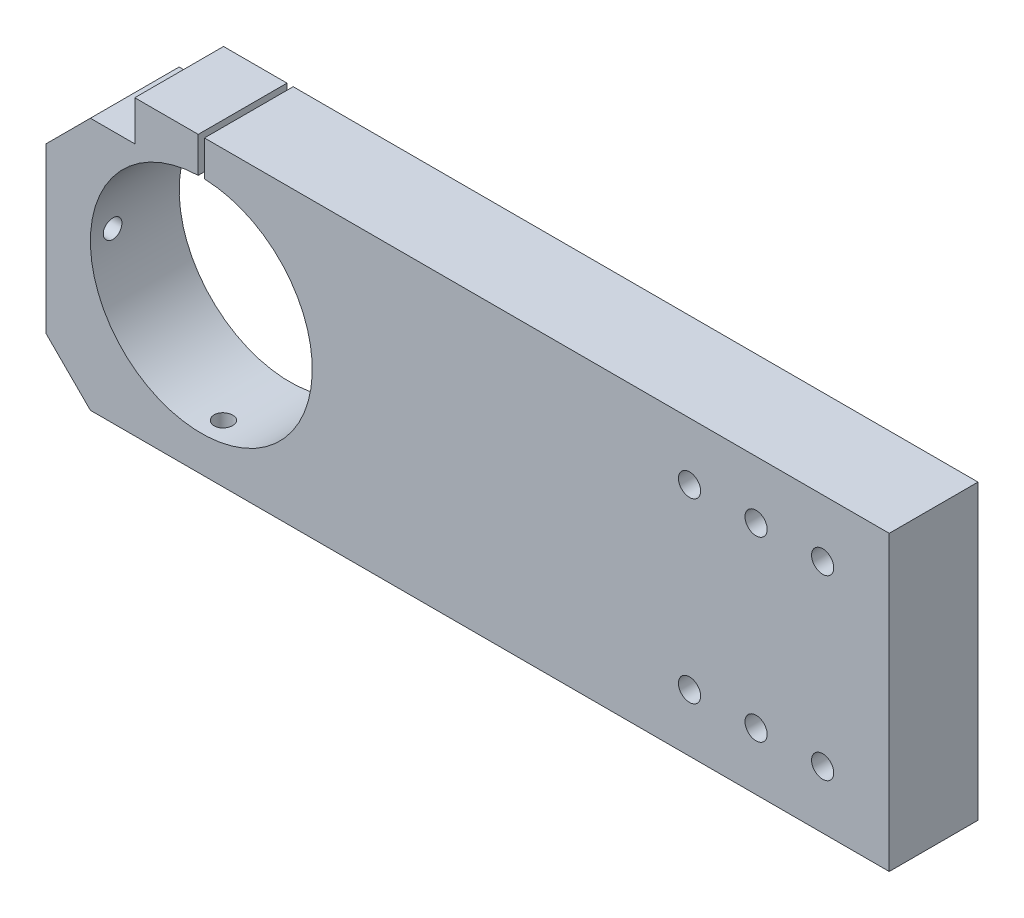
from build123d import *

# Parameters (mm, degrees)
SKETCH_1_W              = 190
SKETCH_1_H              = 66
EXTRUDE_1_DEPTH         = 20
SKETCH_2_R              = 25
CUT_EXTRUDE_1_DEPTH     = 203.12867189
SKETCH_3_W              = 20
SKETCH_3_H              = 9
CUT_EXTRUDE_2_DEPTH     = 203.12867189
SKETCH_4_W              = 1.4
SKETCH_4_H              = 16.93413418
CUT_EXTRUDE_3_DEPTH     = 203.12867189
CHAMFER_1_SIZE          = 10
SKETCH_5_R              = 2.25
CUT_EXTRUDE_4_DEPTH     = 14.3
HOLE_WIZARD_M4_1_D      = 3.3
HOLE_WIZARD_M4_1_DEPTH  = 10.1
HOLE_WIZARD_M4_1_TIP    = 0.991420021
HOLE_WIZARD_M5_1_REACH  = 204.129
HOLE_WIZARD_M5_1_BORE_R = 2.1
HOLE_WIZARD_M5_2_D      = 4.2
HOLE_WIZARD_M5_2_DEPTH  = 12.4
HOLE_WIZARD_M5_2_TIP    = 1.2618073
CHAMFER_2_SIZE          = 10
HOLE_WIZARD_M6_1_D      = 5
PATTERN_LINEAR_1_COUNT  = 3
PATTERN_LINEAR_1_PITCH  = 15


with BuildPart() as part:
    # 草图1 → 凸台-拉伸1 (new body)
    with BuildSketch(Plane.XY):
        with Locations((95, 33)):
            Rectangle(SKETCH_1_W, SKETCH_1_H)
    extrude(amount=EXTRUDE_1_DEPTH)

    # 草图2 → 切除-拉伸1 (cut, through all)
    with BuildSketch(Plane(origin=(0, 0, 0), x_dir=(-1, 0, 0), z_dir=(0, 0, -1))):
        with Locations((-35, 33)):
            Circle(SKETCH_2_R)
    extrude(amount=-CUT_EXTRUDE_1_DEPTH, mode=Mode.SUBTRACT)

    # 草图3 → 切除-拉伸2 (cut, through all)
    with BuildSketch(Plane(origin=(0, 0, 0), x_dir=(-1, 0, 0), z_dir=(0, 0, -1))):
        with Locations((-10, 61.5)):
            Rectangle(SKETCH_3_W, SKETCH_3_H)
    extrude(amount=-CUT_EXTRUDE_2_DEPTH, mode=Mode.SUBTRACT)

    # 草图4 → 切除-拉伸3 (cut, through all)
    with BuildSketch(Plane(origin=(0, 0, 0), x_dir=(-1, 0, 0), z_dir=(0, 0, -1))):
        with Locations((-35, 57.53293291)):
            Rectangle(SKETCH_4_W, SKETCH_4_H)
    extrude(amount=-CUT_EXTRUDE_3_DEPTH, mode=Mode.SUBTRACT)

    # 倒角1
    chamfer_1_edges = [part.edges().sort_by_distance(p)[0] for p in [
        (0, 57, 10),
    ]]
    chamfer(chamfer_1_edges, length=CHAMFER_1_SIZE)

    # 草图5 → 切除-拉伸4 (cut)
    with BuildSketch(Plane.ZY.offset(-20)):
        with Locations(Location((15, 61.5, 0), (0, 0, 270))):
            Circle(SKETCH_5_R)
        with Locations((5, 61.5)):
            Circle(SKETCH_5_R)
    extrude(amount=-CUT_EXTRUDE_4_DEPTH, mode=Mode.SUBTRACT)

    # M4 螺纹孔1
    with Locations(Plane.ZY.offset(-35.7)):
        with Locations((15, 61.5), (5, 61.5)):
            Hole(HOLE_WIZARD_M4_1_D / 2, depth=HOLE_WIZARD_M4_1_DEPTH)
            with Locations((0, 0, -(HOLE_WIZARD_M4_1_DEPTH + HOLE_WIZARD_M4_1_TIP / 2))):  # 118° drill point
                Cone(0, HOLE_WIZARD_M4_1_D / 2, HOLE_WIZARD_M4_1_TIP, mode=Mode.SUBTRACT)

    # M5 螺纹孔1 bore → M5 螺纹孔1 (cut, up to next)
    with BuildSketch(Plane.ZY, mode=Mode.PRIVATE) as hole_wizard_m5_1_sk1:
        with Locations((15, 33)):
            Circle(HOLE_WIZARD_M5_1_BORE_R)
    hole_wizard_m5_1_tool1 = extrude(hole_wizard_m5_1_sk1.sketch, amount=-HOLE_WIZARD_M5_1_REACH, mode=Mode.PRIVATE) & part.part
    add(hole_wizard_m5_1_tool1.solids().sort_by_distance((0, 33, 15))[0], mode=Mode.SUBTRACT)

    # M5 螺纹孔2
    with Locations(Plane.XZ):
        with Locations((35, 15)):
            Hole(HOLE_WIZARD_M5_2_D / 2, depth=HOLE_WIZARD_M5_2_DEPTH)
            with Locations((0, 0, -(HOLE_WIZARD_M5_2_DEPTH + HOLE_WIZARD_M5_2_TIP / 2))):  # 118° drill point
                Cone(0, HOLE_WIZARD_M5_2_D / 2, HOLE_WIZARD_M5_2_TIP, mode=Mode.SUBTRACT)

    # 倒角2
    chamfer_2_edges = [part.edges().sort_by_distance(p)[0] for p in [
        (0, 0, 10),
    ]]
    chamfer(chamfer_2_edges, length=CHAMFER_2_SIZE)

    # M6 螺纹孔1 (through all)
    with Locations(Plane(origin=(0, 0, 0), x_dir=(-1, 0, 0), z_dir=(0, 0, -1))):
        with Locations((-175, 53), (-175, 13)):
            hole_wizard_m6_1 = Hole(HOLE_WIZARD_M6_1_D / 2)

    # 阵列(线性)1: M6 螺纹孔1 ×3
    with Locations(*[(-i * PATTERN_LINEAR_1_PITCH, 0, 0) for i in range(1, PATTERN_LINEAR_1_COUNT)]):
        add(hole_wizard_m6_1, mode=Mode.SUBTRACT)


solid = part.part
